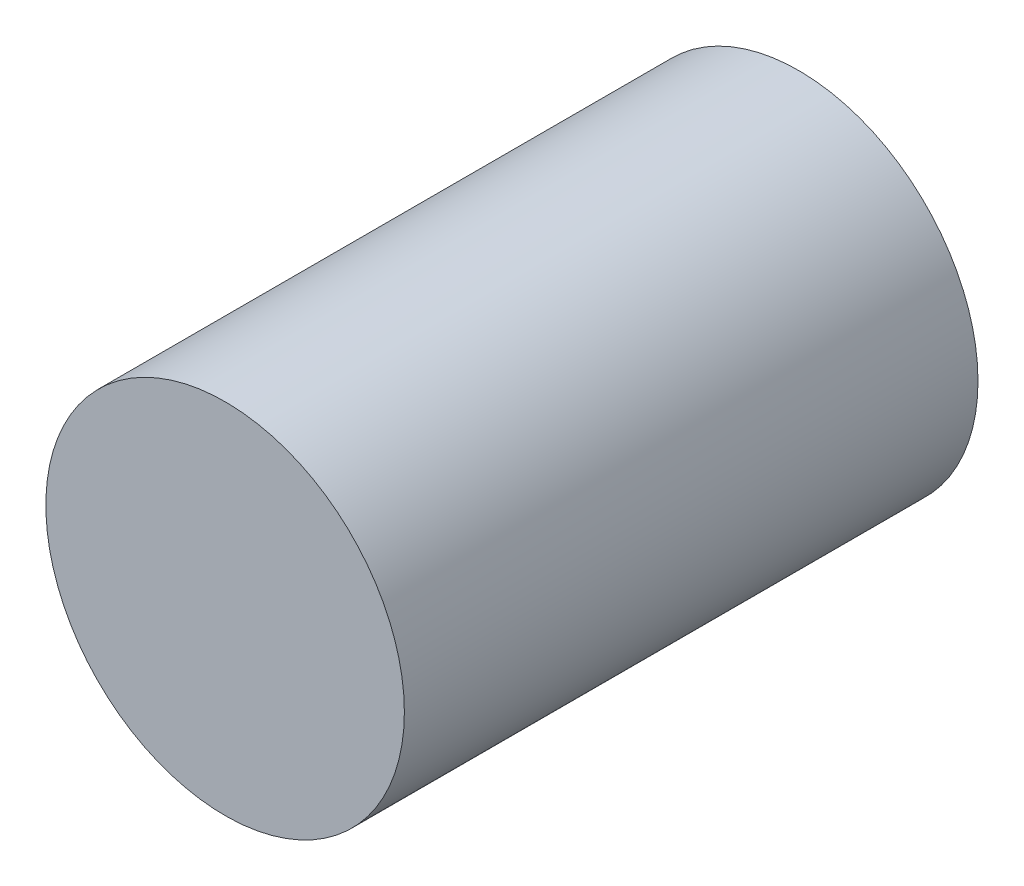
from build123d import *

# Parameters (mm, degrees)
SKETCH_1_R      = 2.5
EXTRUDE_1_DEPTH = 8


with BuildPart() as part:
    # 草图1 → 凸台-拉伸1 (new body)
    with BuildSketch(Plane.XY):
        with Locations((-5.79767482, 10.140038114)):
            Circle(SKETCH_1_R)
    extrude(amount=EXTRUDE_1_DEPTH)


solid = part.part
